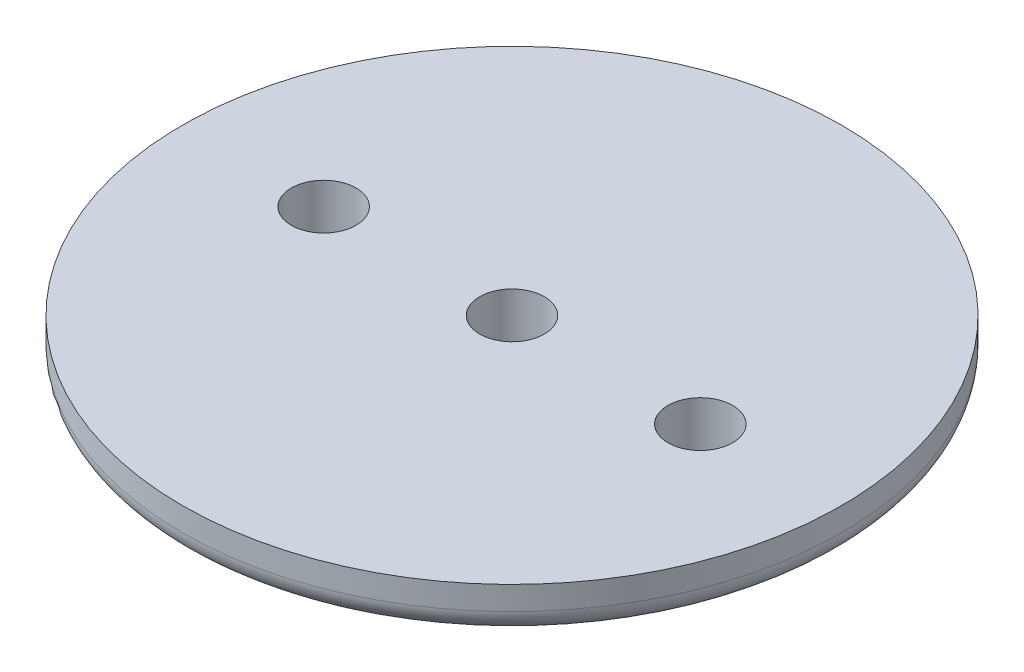
from build123d import *

# Parameters (mm, degrees)
CUT_EXTRUDE1_DEPTH      = 32.590851198
CUT_EXTRUDE1_DEPTH_BACK = 32.590851198
SKETCH2_R               = 2.1828125


with BuildPart() as part:
    # Sketch1 → Revolve1 (revolve)
    with BuildSketch(Plane.XY, mode=Mode.PRIVATE) as revolve1_sk:
        with BuildLine():
            Line((0, 0), (20.6375, 0))
            ThreePointArc((20.6375, 0), (21.760032015, 0.464967985), (22.225, 1.5875))
            Line((22.225, 1.5875), (22.225, 3.175))
            Line((22.225, 3.175), (0, 3.175))
            Line((0, 3.175), (0, 0))
        make_face()
    revolve(revolve1_sk.sketch.rotate(Axis((0, 0, 0), (0, 1, 0)), 90), axis=Axis((0, 0, 0), (0, 1, 0)))

    # Sketch2 → Cut-Extrude1 (cut, two sides: drawn at the far end of the back side and taken through both)
    with BuildSketch(Plane(origin=(0, 3.175, 0), x_dir=(1, 0, 0), z_dir=(0, 1, 0)).offset(-CUT_EXTRUDE1_DEPTH_BACK)):
        with Locations(Location((0, 0, 0), (0, 0, 270))):
            Circle(SKETCH2_R)
        with Locations(Location((12.7, 0, 0), (0, 0, 270))):
            Circle(SKETCH2_R)
        with Locations(Location((-12.7, 0, 0), (0, 0, 270))):
            Circle(SKETCH2_R)
    extrude(amount=CUT_EXTRUDE1_DEPTH + CUT_EXTRUDE1_DEPTH_BACK, mode=Mode.SUBTRACT)


solid = part.part
